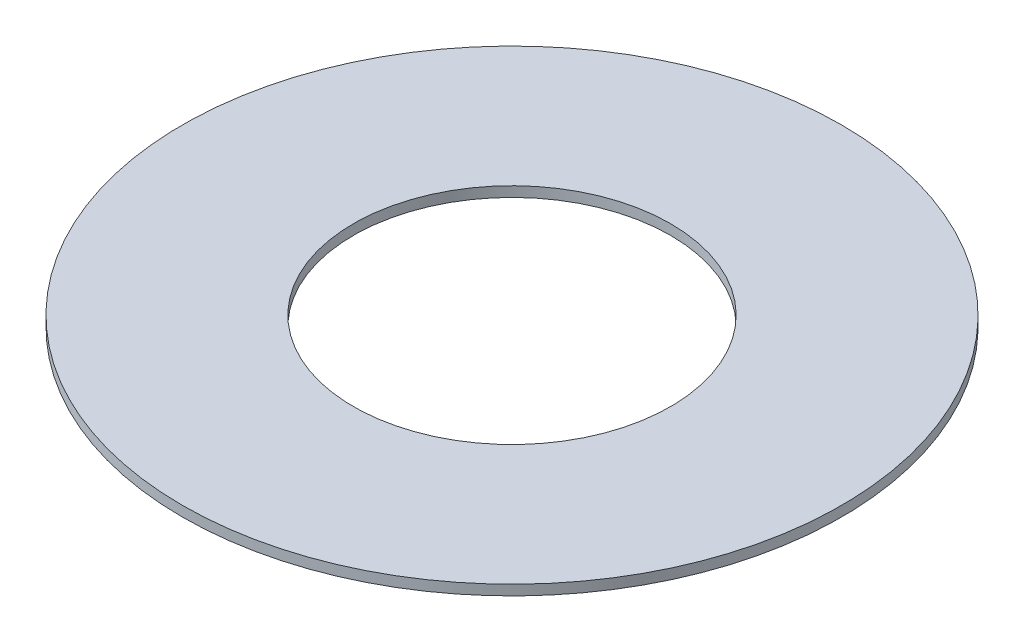
from build123d import *

# Parameters (mm, degrees)
SKETCH1_W    = 233.415272748
SKETCH1_H    = 13.873483364
SCALE1_SCALE = 5
SCALE2_SCALE = 0.8


with BuildPart() as part:
    # Sketch1 → Revolve1 (revolve)
    with BuildSketch(Plane.XY, mode=Mode.PRIVATE) as revolve1_sk:
        with Locations((5.476375012, 16.429125037)):
            Rectangle(SKETCH1_W, SKETCH1_H)
    revolve(revolve1_sk.sketch.rotate(Axis((-327.570639078, 9.492383355, 0), (0, 1, 0)), 90), axis=Axis((-327.570639078, 9.492383355, 0), (0, 1, 0)))


with BuildPart() as part_1:
    # Scale1: scaled about (-327.570639078, 16.429125037, 0)
    add(part.part.scale(SCALE1_SCALE).moved(Location((1310.282556312, -65.716500148, 0))))


with BuildPart() as part_2:
    # Scale2: scaled about (-327.570639076, 16.429125037, 0)
    add(part_1.part.scale(SCALE2_SCALE).moved(Location((-65.514127815, 3.285825007, 0))))


solid = part_2.part
